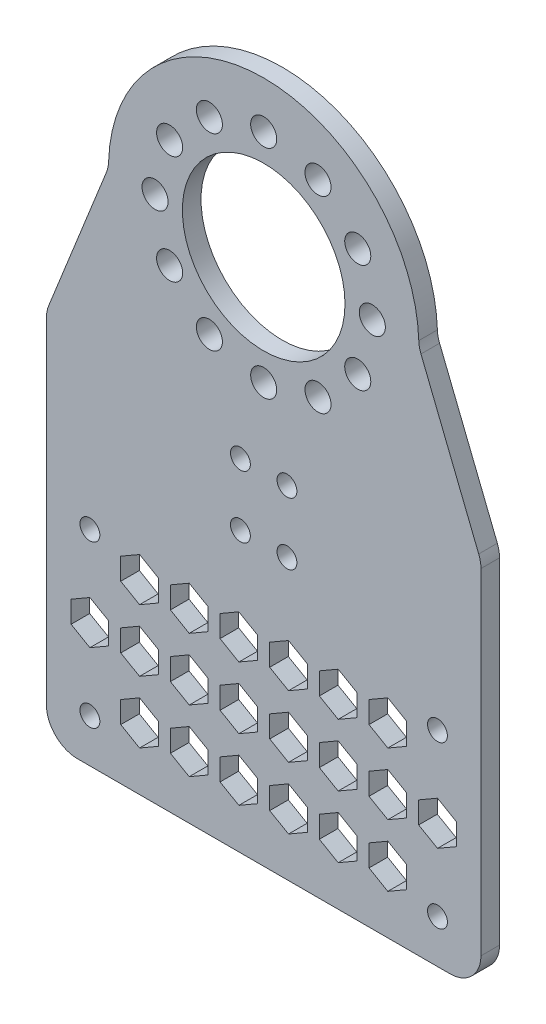
from build123d import *

# Parameters (mm, degrees)
SKETCH_1_R      = 13.1
SKETCH_1_R_2    = 1.6
SKETCH_1_R_3    = 2.1
EXTRUDE_1_DEPTH = 3
FILLET_1_R      = 5


with BuildPart() as part:
    # 草图1 → 凸台-拉伸1 (new body)
    with BuildSketch(Plane.XY):
        with BuildLine():
            Line((-35, 0), (-35, -60))
            Line((-35, -60), (-20, -60))
            Line((-20, -60), (20, -60))
            Line((20, -60), (35, -60))
            Line((35, -60), (35, 0))
            Line((35, 0), (25, 25))
            ThreePointArc((25, 25), (0, 50), (-25, 25))
            Line((-25, 25), (-35, 0))
        make_face()
        with Locations((0, 25)):
            Circle(SKETCH_1_R, mode=Mode.SUBTRACT)
        with Locations((-28, -53)):
            Circle(SKETCH_1_R_2, mode=Mode.SUBTRACT)
        with Locations((-28, -27)):
            Circle(SKETCH_1_R_2, mode=Mode.SUBTRACT)
        with Locations((28, -27)):
            Circle(SKETCH_1_R_2, mode=Mode.SUBTRACT)
        with Locations((28, -53)):
            Circle(SKETCH_1_R_2, mode=Mode.SUBTRACT)
        with Locations((0, 7.5)):
            Circle(SKETCH_1_R_3, mode=Mode.SUBTRACT)
        with Locations((-8.75, 9.844555434)):
            Circle(SKETCH_1_R_3, mode=Mode.SUBTRACT)
        with Locations((-15.155444566, 16.25)):
            Circle(SKETCH_1_R_3, mode=Mode.SUBTRACT)
        with Locations((-17.5, 25)):
            Circle(SKETCH_1_R_3, mode=Mode.SUBTRACT)
        with Locations((-15.155444566, 33.75)):
            Circle(SKETCH_1_R_3, mode=Mode.SUBTRACT)
        with Locations((-8.75, 40.155444566)):
            Circle(SKETCH_1_R_3, mode=Mode.SUBTRACT)
        with Locations((0, 42.5)):
            Circle(SKETCH_1_R_3, mode=Mode.SUBTRACT)
        with Locations((8.75, 40.155444566)):
            Circle(SKETCH_1_R_3, mode=Mode.SUBTRACT)
        with Locations((15.155444566, 33.75)):
            Circle(SKETCH_1_R_3, mode=Mode.SUBTRACT)
        with Locations((17.5, 25)):
            Circle(SKETCH_1_R_3, mode=Mode.SUBTRACT)
        with Locations((15.155444566, 16.25)):
            Circle(SKETCH_1_R_3, mode=Mode.SUBTRACT)
        with Locations((8.75, 9.844555434)):
            Circle(SKETCH_1_R_3, mode=Mode.SUBTRACT)
        with Locations((-3.75, -5)):
            Circle(SKETCH_1_R_2, mode=Mode.SUBTRACT)
        with Locations((3.75, -5)):
            Circle(SKETCH_1_R_2, mode=Mode.SUBTRACT)
        with Locations((3.75, -15)):
            Circle(SKETCH_1_R_2, mode=Mode.SUBTRACT)
        with Locations((-3.75, -15)):
            Circle(SKETCH_1_R_2, mode=Mode.SUBTRACT)
        Polygon((-24.968911087, -38.25), (-28, -36.5), (-31.031088913, -38.25), (-31.031088913, -41.75), (-28, -43.5), (-24.968911087, -41.75), align=None, mode=Mode.SUBTRACT)
        Polygon((-16.968911087, -38.25), (-20, -36.5), (-23.031088913, -38.25), (-23.031088913, -41.75), (-20, -43.5), (-16.968911087, -41.75), align=None, mode=Mode.SUBTRACT)
        Polygon((-8.968911087, -38.25), (-12, -36.5), (-15.031088913, -38.25), (-15.031088913, -41.75), (-12, -43.5), (-8.968911087, -41.75), align=None, mode=Mode.SUBTRACT)
        Polygon((-0.968911087, -38.25), (-4, -36.5), (-7.031088913, -38.25), (-7.031088913, -41.75), (-4, -43.5), (-0.968911087, -41.75), align=None, mode=Mode.SUBTRACT)
        Polygon((7.031088913, -38.25), (4, -36.5), (0.968911087, -38.25), (0.968911087, -41.75), (4, -43.5), (7.031088913, -41.75), align=None, mode=Mode.SUBTRACT)
        Polygon((15.031088913, -38.25), (12, -36.5), (8.968911087, -38.25), (8.968911087, -41.75), (12, -43.5), (15.031088913, -41.75), align=None, mode=Mode.SUBTRACT)
        Polygon((23.031088913, -38.25), (20, -36.5), (16.968911087, -38.25), (16.968911087, -41.75), (20, -43.5), (23.031088913, -41.75), align=None, mode=Mode.SUBTRACT)
        Polygon((31.031088913, -38.25), (28, -36.5), (24.968911087, -38.25), (24.968911087, -41.75), (28, -43.5), (31.031088913, -41.75), align=None, mode=Mode.SUBTRACT)
        Polygon((-16.968911087, -48.25), (-20, -46.5), (-23.031088913, -48.25), (-23.031088913, -51.75), (-20, -53.5), (-16.968911087, -51.75), align=None, mode=Mode.SUBTRACT)
        Polygon((23.031088913, -48.25), (20, -46.5), (16.968911087, -48.25), (16.968911087, -51.75), (20, -53.5), (23.031088913, -51.75), align=None, mode=Mode.SUBTRACT)
        Polygon((-0.968911087, -48.25), (-4, -46.5), (-7.031088913, -48.25), (-7.031088913, -51.75), (-4, -53.5), (-0.968911087, -51.75), align=None, mode=Mode.SUBTRACT)
        Polygon((-8.968911087, -48.25), (-12, -46.5), (-15.031088913, -48.25), (-15.031088913, -51.75), (-12, -53.5), (-8.968911087, -51.75), align=None, mode=Mode.SUBTRACT)
        Polygon((7.031088913, -48.25), (4, -46.5), (0.968911087, -48.25), (0.968911087, -51.75), (4, -53.5), (7.031088913, -51.75), align=None, mode=Mode.SUBTRACT)
        Polygon((15.031088913, -48.25), (12, -46.5), (8.968911087, -48.25), (8.968911087, -51.75), (12, -53.5), (15.031088913, -51.75), align=None, mode=Mode.SUBTRACT)
        Polygon((-16.968911087, -28.25), (-20, -26.5), (-23.031088913, -28.25), (-23.031088913, -31.75), (-20, -33.5), (-16.968911087, -31.75), align=None, mode=Mode.SUBTRACT)
        Polygon((-8.968911087, -28.25), (-12, -26.5), (-15.031088913, -28.25), (-15.031088913, -31.75), (-12, -33.5), (-8.968911087, -31.75), align=None, mode=Mode.SUBTRACT)
        Polygon((-0.968911087, -28.25), (-4, -26.5), (-7.031088913, -28.25), (-7.031088913, -31.75), (-4, -33.5), (-0.968911087, -31.75), align=None, mode=Mode.SUBTRACT)
        Polygon((7.031088913, -28.25), (4, -26.5), (0.968911087, -28.25), (0.968911087, -31.75), (4, -33.5), (7.031088913, -31.75), align=None, mode=Mode.SUBTRACT)
        Polygon((15.031088913, -28.25), (12, -26.5), (8.968911087, -28.25), (8.968911087, -31.75), (12, -33.5), (15.031088913, -31.75), align=None, mode=Mode.SUBTRACT)
        Polygon((23.031088913, -28.25), (20, -26.5), (16.968911087, -28.25), (16.968911087, -31.75), (20, -33.5), (23.031088913, -31.75), align=None, mode=Mode.SUBTRACT)
    extrude(amount=EXTRUDE_1_DEPTH)

    # 圆角1
    fillet_1_edges = [part.edges().sort_by_distance(p)[0] for p in [
        (25, 25, 1.5),
        (35, 0, 1.5),
        (35, -60, 1.5),
        (-35, -60, 1.5),
        (-35, 0, 1.5),
        (-25, 25, 1.5),
    ]]
    fillet(fillet_1_edges, radius=FILLET_1_R)


solid = part.part
